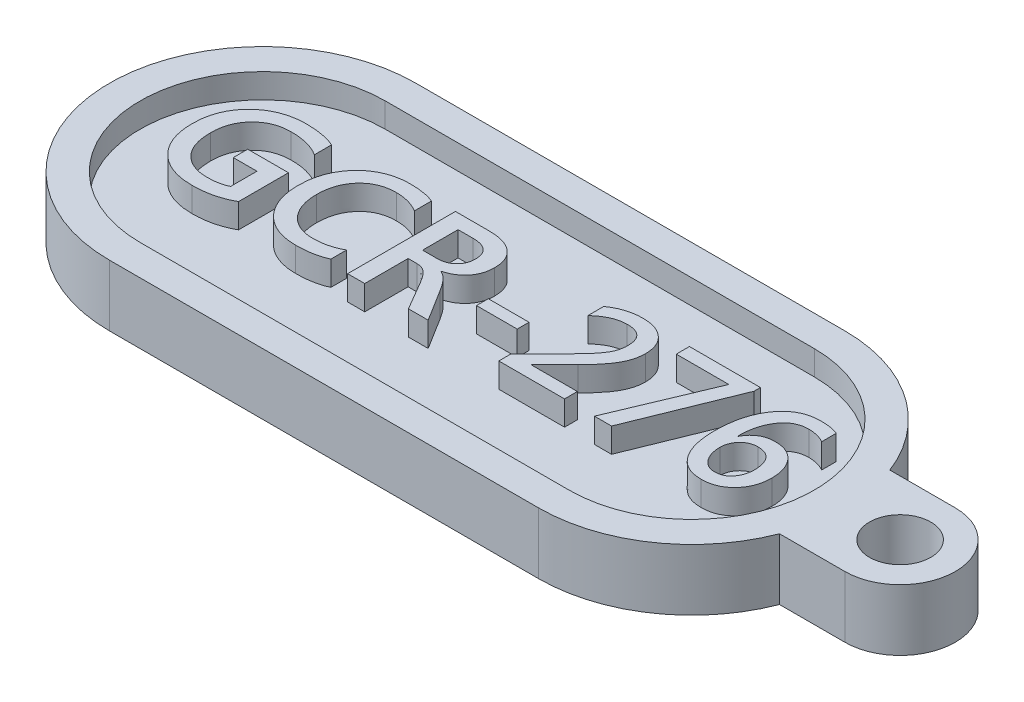
from build123d import *

# Parameters (mm, degrees)
EXTRUDE_1_DEPTH     = 5
CUT_EXTRUDE_1_DEPTH = 2
SKETCH_3_W          = 3.324021386
SKETCH_3_H          = 0.965038467
EXTRUDE_3_DEPTH     = 2
EXTRUDE_START       = -5
SKETCH_4_R          = 2.5
EXTRUDE_4_DEPTH     = 5


with BuildPart() as part:
    # 草圖1 → 填料-伸長1 (new body)
    with BuildSketch(Plane(origin=(0, 0, 0), x_dir=(1, 0, 0), z_dir=(0, 1, 0))):
        with BuildLine():
            Line((0, 12.5), (35, 12.5))
            ThreePointArc((35, 12.5), (47.5, 0), (35, -12.5))
            Line((35, -12.5), (0, -12.5))
            ThreePointArc((0, -12.5), (-12.5, 0), (0, 12.5))
        make_face()
    extrude(amount=EXTRUDE_1_DEPTH)

    # 草圖2 → 除料-伸長1 (cut)
    with BuildSketch(Plane(origin=(0, 5, 0), x_dir=(1, 0, 0), z_dir=(0, 1, 0))):
        with BuildLine():
            Line((0, -10), (35, -10))
            ThreePointArc((35, -10), (45, 0), (35, 10))
            Line((35, 10), (0, 10))
            ThreePointArc((0, 10), (-10, 0), (0, -10))
        make_face()
    extrude(amount=-CUT_EXTRUDE_1_DEPTH, mode=Mode.SUBTRACT)

    # 草圖3 → 填料-伸長3 (add)
    # profile 1 of 7: a face of its own
    with BuildSketch(Plane(origin=(0, 3, 0), x_dir=(1, 0, 0), z_dir=(0, 1, 0))):
        with BuildLine():
            add(Edge.make_bspline(
                [(1.130659793, -3.097159366), (1.019253484, -3.157505942), (0.795861792, -3.278512768), (0.444456536, -3.429566541), (0.081917786, -3.559128311), (-0.293630756, -3.66515192), (-0.68218148, -3.746765958), (-1.083381224, -3.805024328), (-1.496836615, -3.84126153), (-1.776667152, -3.845563125), (-1.918593697, -3.84774484)],
                knots=[0, 0, 0, 0, 0.957138089, 1.91925125, 2.887114869, 3.865167626, 4.865969151, 5.885472766, 6.927538269, 8, 8, 8, 8], degree=3))
            add(Edge.make_bspline(
                [(-1.918593697, -3.84774484), (-2.079584662, -3.844320978), (-2.394180526, -3.837630336), (-2.853703725, -3.782048463), (-3.287879366, -3.687371257), (-3.698830364, -3.560254118), (-4.082951545, -3.390308969), (-4.444514056, -3.1873112), (-4.780641428, -2.945157695), (-5.088711414, -2.666239458), (-5.366829262, -2.357742677), (-5.607791666, -2.019292881), (-5.813593187, -1.656550674), (-5.978864681, -1.266331283), (-6.110827777, -0.852722478), (-6.201556244, -0.412456478), (-6.258054494, 0.052815525), (-6.264613091, 0.371896915), (-6.267968454, 0.535138198)],
                knots=[0, 0, 0, 0, 1.107989924, 2.165146631, 3.180093165, 4.163722251, 5.120842657, 6.065943663, 7.013379634, 7.966073561, 8.921625378, 9.866820206, 10.820506458, 11.786679049, 12.778798332, 13.80421889, 14.876643591, 16, 16, 16, 16], degree=3))
            add(Edge.make_bspline(
                [(-6.267968454, 0.535138198), (-6.264350434, 0.70063782), (-6.257246718, 1.025584154), (-6.194255024, 1.5009336), (-6.089629116, 1.953398039), (-5.946663418, 2.383724926), (-5.758839432, 2.790647357), (-5.52997145, 3.173986767), (-5.260242121, 3.534747482), (-4.951083829, 3.868537839), (-4.608730533, 4.169556821), (-4.242549929, 4.437495759), (-3.849472947, 4.660369843), (-3.433922234, 4.844531928), (-2.993094901, 4.984710187), (-2.530074341, 5.08695358), (-2.042545642, 5.148294788), (-1.70990325, 5.155565905), (-1.539950131, 5.159280852)],
                knots=[0, 0, 0, 0, 1.069823103, 2.100518975, 3.093908996, 4.069174194, 5.027374187, 5.98610484, 6.951045497, 7.934917876, 8.922501358, 9.894793384, 10.863659021, 11.838643361, 12.828805145, 13.849577504, 14.901309579, 16, 16, 16, 16], degree=3))
            add(Edge.make_bspline(
                [(-1.539950131, 5.159280852), (-1.422632813, 5.15819235), (-1.191697059, 5.156049665), (-0.852425097, 5.133297086), (-0.52522666, 5.098864547), (-0.211614919, 5.048523283), (0.090114212, 4.98537216), (0.37787268, 4.906059527), (0.654050258, 4.815519234), (0.829567858, 4.740566425), (0.9162068, 4.703568243)],
                knots=[0, 0, 0, 0, 1.118819135, 2.202363179, 3.241788239, 4.255886137, 5.230622063, 6.180412027, 7.101815561, 8, 8, 8, 8], degree=3))
            Line((0.9162068, 4.703568243), (0.9162068, 3.309623791))
            add(Edge.make_bspline(
                [(0.9162068, 3.309623791), (0.826640041, 3.363786544), (0.646589506, 3.472666588), (0.358227687, 3.606526606), (0.058093278, 3.723314059), (-0.256570087, 3.816298628), (-0.584346031, 3.890960517), (-0.926625957, 3.941410997), (-1.28294617, 3.974823259), (-1.525350605, 3.978113211), (-1.648852042, 3.979789393)],
                knots=[0, 0, 0, 0, 0.934304809, 1.878175359, 2.835136939, 3.808892105, 4.806079926, 5.83539023, 6.897163674, 8, 8, 8, 8], degree=3))
            add(Edge.make_bspline(
                [(-1.648852042, 3.979789393), (-1.764599743, 3.976910385), (-1.991353841, 3.9712703), (-2.323396391, 3.926482229), (-2.63940132, 3.855019237), (-2.939716043, 3.754555545), (-3.223350867, 3.622808161), (-3.489971833, 3.46109732), (-3.741932302, 3.271994998), (-3.975181888, 3.055413509), (-4.185130734, 2.814300158), (-4.371675313, 2.55592628), (-4.52577667, 2.276704341), (-4.65398828, 1.980728668), (-4.752991476, 1.665652536), (-4.822093435, 1.332229763), (-4.867665069, 0.981497864), (-4.871876478, 0.741361603), (-4.874024002, 0.618908898)],
                knots=[0, 0, 0, 0, 1.06102007, 2.078578193, 3.066161544, 4.028066276, 4.976573964, 5.92769069, 6.882220097, 7.860559593, 8.840398954, 9.80952819, 10.776937682, 11.758648651, 12.762781852, 13.799272853, 14.877783005, 16, 16, 16, 16], degree=3))
            add(Edge.make_bspline(
                [(-4.874024002, 0.618908898), (-4.871501571, 0.493141622), (-4.866590014, 0.248253546), (-4.826995708, -0.108503178), (-4.765106664, -0.444790604), (-4.67339191, -0.758807801), (-4.561123035, -1.053469369), (-4.416352305, -1.323676051), (-4.250961405, -1.575828437), (-4.057792476, -1.803420011), (-3.842415432, -2.006404107), (-3.609199728, -2.185380669), (-3.35611372, -2.33556974), (-3.084306998, -2.455517568), (-2.795721485, -2.552284267), (-2.48861555, -2.620192249), (-2.163191543, -2.660980521), (-1.94049519, -2.665790203), (-1.826445926, -2.66825338)],
                knots=[0, 0, 0, 0, 1.188621482, 2.314427373, 3.389202348, 4.416793506, 5.40307169, 6.364246269, 7.308688229, 8.248974615, 9.178888234, 10.101761511, 11.022578782, 11.953690551, 12.905306186, 13.895392135, 14.922169253, 16, 16, 16, 16], degree=3))
            add(Edge.make_bspline(
                [(-1.826445926, -2.66825338), (-1.750467102, -2.667337474), (-1.601705329, -2.665544187), (-1.383078767, -2.650039696), (-1.173874167, -2.625369235), (-0.973620329, -2.590110998), (-0.782226505, -2.545002542), (-0.599746813, -2.489858403), (-0.426314706, -2.425256032), (-0.317090205, -2.372541715), (-0.263284659, -2.346573891)],
                knots=[0, 0, 0, 0, 1.132210773, 2.216797709, 3.264643496, 4.270390876, 5.245467881, 6.193346498, 7.110016752, 8, 8, 8, 8], degree=3))
            Line((-0.263284659, -2.346573891), (-0.263284659, -0.202043964))
            Line((-0.263284659, -0.202043964), (-2.193361593, -0.202043964))
            Line((-2.193361593, -0.202043964), (-2.193361593, 0.977447495))
            Line((-2.193361593, 0.977447495), (1.130659793, 0.977447495))
            Line((1.130659793, 0.977447495), (1.130659793, -3.097159366))
        make_face()
    # profile 2 of 7: a face of its own
    with BuildSketch(Plane(origin=(0, 3, 0), x_dir=(1, 0, 0), z_dir=(0, 1, 0))):
        with BuildLine():
            add(Edge.make_bspline(
                [(8.958194026, -3.392032231), (8.876040138, -3.429002668), (8.709609567, -3.50389883), (8.44536449, -3.595418239), (8.166800697, -3.673943753), (7.871765321, -3.737175366), (7.562597209, -3.78756191), (7.237042439, -3.821902252), (6.896641322, -3.844531212), (6.664031799, -3.846660636), (6.545597858, -3.84774484)],
                knots=[0, 0, 0, 0, 0.873229781, 1.769023159, 2.708553228, 3.678358573, 4.693321154, 5.744689587, 6.851700922, 8, 8, 8, 8], degree=3))
            add(Edge.make_bspline(
                [(6.545597858, -3.84774484), (6.393529579, -3.844306335), (6.095609591, -3.837569892), (5.66061916, -3.781909608), (5.248769354, -3.687926988), (4.86046036, -3.556829521), (4.493770932, -3.391032965), (4.15132129, -3.184613153), (3.832500537, -2.941008354), (3.539097671, -2.662151994), (3.27502196, -2.353798892), (3.046234601, -2.017572535), (2.850890399, -1.659242838), (2.690423464, -1.27666281), (2.569554447, -0.868945639), (2.480092863, -0.43872407), (2.428343203, 0.0156153), (2.421087015, 0.32613982), (2.417377749, 0.484875778)],
                knots=[0, 0, 0, 0, 1.081812089, 2.119399567, 3.114266169, 4.083181305, 5.031045332, 5.972246394, 6.922066112, 7.880624707, 8.847451274, 9.80531765, 10.769166742, 11.747078106, 12.751589147, 13.790507572, 14.870537192, 16, 16, 16, 16], degree=3))
            add(Edge.make_bspline(
                [(2.417377749, 0.484875778), (2.421195072, 0.650925585), (2.428687246, 0.976827841), (2.488836707, 1.453872378), (2.584699532, 1.909238626), (2.723792998, 2.341054597), (2.89663534, 2.753152571), (3.11576431, 3.139155287), (3.368727873, 3.505635995), (3.662272421, 3.84327499), (3.98283169, 4.15300276), (4.33159037, 4.422948632), (4.704139568, 4.649794507), (5.097955993, 4.837273464), (5.514612968, 4.981294021), (5.95278147, 5.085345047), (6.414174943, 5.14869969), (6.729689772, 5.155705159), (6.890733143, 5.159280852)],
                knots=[0, 0, 0, 0, 1.098062339, 2.155142483, 3.175320911, 4.1718764, 5.151715059, 6.125889682, 7.102505752, 8.09261102, 9.080232189, 10.046727831, 11.003409711, 11.960170045, 12.926354998, 13.913768876, 14.9351572, 16, 16, 16, 16], degree=3))
            add(Edge.make_bspline(
                [(6.890733143, 5.159280852), (6.992404083, 5.158543053), (7.190866448, 5.157102863), (7.481989035, 5.13923833), (7.760519011, 5.113515882), (8.025963648, 5.074669037), (8.278505234, 5.027004348), (8.516906832, 4.965626626), (8.743820231, 4.897141182), (8.887644368, 4.839211048), (8.958194026, 4.810794739)],
                knots=[0, 0, 0, 0, 1.156157513, 2.256827338, 3.316087736, 4.33651165, 5.306901744, 6.237369836, 7.135381876, 8, 8, 8, 8], degree=3))
            Line((8.958194026, 4.810794739), (8.958194026, 3.416850287))
            add(Edge.make_bspline(
                [(8.958194026, 3.416850287), (8.881798413, 3.462213922), (8.729761728, 3.552493148), (8.490275122, 3.66546423), (8.246078747, 3.763376312), (7.99494142, 3.841885643), (7.738242534, 3.90472569), (7.474870841, 3.947126293), (7.205779385, 3.975607925), (7.024282597, 3.978386225), (6.932618493, 3.979789393)],
                knots=[0, 0, 0, 0, 1.000698145, 1.991512659, 2.980166353, 3.963397223, 4.954011858, 5.955501226, 6.967435452, 8, 8, 8, 8], degree=3))
            add(Edge.make_bspline(
                [(6.932618493, 3.979789393), (6.817443416, 3.976861067), (6.592383369, 3.971138918), (6.263836912, 3.927414081), (5.953268445, 3.852719056), (5.658212306, 3.752014897), (5.382984758, 3.616052101), (5.123742712, 3.454524694), (4.882937392, 3.261876089), (4.661426884, 3.040979561), (4.460782573, 2.797917505), (4.287471268, 2.533835389), (4.13855442, 2.253507923), (4.020391082, 1.952803083), (3.925860674, 1.635122824), (3.859689006, 1.298561946), (3.818615738, 0.944402561), (3.813786002, 0.702235853), (3.811322202, 0.578698962)],
                knots=[0, 0, 0, 0, 1.063652607, 2.078450591, 3.054364451, 4.010361573, 4.95163226, 5.883370162, 6.826744596, 7.793357237, 8.768234429, 9.732531893, 10.706275672, 11.694827412, 12.711668615, 13.763788352, 14.859237769, 16, 16, 16, 16], degree=3))
            add(Edge.make_bspline(
                [(3.811322202, 0.578698962), (3.813126277, 0.460732417), (3.816659189, 0.229719036), (3.857472231, -0.10782051), (3.917063397, -0.429166653), (4.00793224, -0.732315009), (4.11833554, -1.019542288), (4.257961504, -1.288220733), (4.420078369, -1.540466865), (4.608144392, -1.773043699), (4.815543641, -1.98356534), (5.043308316, -2.166250283), (5.285953266, -2.323558097), (5.548474091, -2.448715225), (5.826328027, -2.549697833), (6.122733175, -2.615396838), (6.434653816, -2.662260091), (6.648727034, -2.666223381), (6.758375437, -2.66825338)],
                knots=[0, 0, 0, 0, 1.14570342, 2.243626122, 3.299431414, 4.317736089, 5.314423708, 6.285290861, 7.254700848, 8.223442235, 9.18663467, 10.120627236, 11.055470792, 11.989936226, 12.940896808, 13.921603267, 14.935444215, 16, 16, 16, 16], degree=3))
            add(Edge.make_bspline(
                [(6.758375437, -2.66825338), (6.861201738, -2.666868022), (7.063865509, -2.664137575), (7.36309075, -2.635786782), (7.653236035, -2.593492502), (7.933427124, -2.530772224), (8.204723294, -2.452436588), (8.46575248, -2.354566187), (8.718803293, -2.24183406), (8.878469421, -2.150779635), (8.958194026, -2.105314274)],
                knots=[0, 0, 0, 0, 1.073382705, 2.115565596, 3.135735895, 4.133203503, 5.111254161, 6.081800706, 7.04220336, 8, 8, 8, 8], degree=3))
            Line((8.958194026, -2.105314274), (8.958194026, -3.392032231))
        make_face()
    # profile 3 of 7: a face of its own
    with BuildSketch(Plane(origin=(0, 3, 0), x_dir=(1, 0, 0), z_dir=(0, 1, 0))):
        with BuildLine():
            Line((17.241440868, -3.740518344), (15.633043423, -3.740518344))
            Line((15.633043423, -3.740518344), (14.260879352, -1.393263322))
            add(Edge.make_bspline(
                [(14.260879352, -1.393263322), (14.228244511, -1.33778643), (14.16505205, -1.230363774), (14.068452371, -1.077933767), (13.97237545, -0.940651318), (13.880538643, -0.815900753), (13.790215528, -0.704921316), (13.701327402, -0.608136601), (13.616646079, -0.523078706), (13.504828759, -0.432338562), (13.362378576, -0.33875511), (13.177469773, -0.25814653), (12.979959798, -0.210141185), (12.843741799, -0.204765288), (12.77478713, -0.202043964)],
                knots=[0, 0, 0, 0, 1.154342948, 2.235211453, 3.235478647, 4.158981251, 5.013123199, 5.800080655, 6.515450744, 7.163104964, 8.379980877, 9.559726322, 10.764713421, 12, 12, 12, 12], degree=3))
            Line((12.77478713, -0.202043964), (12.067762419, -0.202043964))
            Line((12.067762419, -0.202043964), (12.067762419, -3.740518344))
            Line((12.067762419, -3.740518344), (10.673817967, -3.740518344))
            Line((10.673817967, -3.740518344), (10.673817967, 5.052054356))
            Line((10.673817967, 5.052054356), (13.43154942, 5.052054356))
            add(Edge.make_bspline(
                [(13.43154942, 5.052054356), (13.540513575, 5.05008016), (13.752684245, 5.046236083), (14.061793205, 5.017728289), (14.35213217, 4.970011017), (14.622767347, 4.901251355), (14.874777199, 4.813942553), (15.108328133, 4.70734968), (15.322096258, 4.579364952), (15.516136113, 4.432999166), (15.688924087, 4.26900643), (15.83940039, 4.087826917), (15.968228648, 3.891303153), (16.06981247, 3.676332951), (16.150711317, 3.446731998), (16.209781055, 3.201015919), (16.242735804, 2.938024131), (16.247267686, 2.757385791), (16.249595777, 2.664589399)],
                knots=[0, 0, 0, 0, 1.246590689, 2.427311831, 3.548161916, 4.609745165, 5.618131739, 6.595930334, 7.541634735, 8.46304448, 9.37149059, 10.260791202, 11.152269932, 12.052521811, 12.974064481, 13.933399661, 14.938359062, 16, 16, 16, 16], degree=3))
            add(Edge.make_bspline(
                [(16.249595777, 2.664589399), (16.247848518, 2.591376607), (16.24439833, 2.446808528), (16.221253413, 2.234265404), (16.180205954, 2.03000685), (16.12559572, 1.833446322), (16.053330899, 1.644891683), (15.963414245, 1.465056988), (15.860174939, 1.292387533), (15.74065656, 1.129215641), (15.605984937, 0.976858832), (15.459249385, 0.834362813), (15.298852795, 0.705165341), (15.12686361, 0.586661621), (14.941205034, 0.481448175), (14.742025803, 0.390220696), (14.532598307, 0.306129762), (14.385839976, 0.263591967), (14.311141773, 0.241940747)],
                knots=[0, 0, 0, 0, 1.046481847, 2.066413079, 3.051124139, 4.02152713, 4.979206117, 5.932383219, 6.892056265, 7.851629706, 8.818842683, 9.795496585, 10.771661027, 11.759183014, 12.778020318, 13.817261469, 14.889012671, 16, 16, 16, 16], degree=3))
            Line((14.311141773, 0.241940747), (14.311141773, 0.220160365))
            add(Edge.make_bspline(
                [(14.311141773, 0.220160365), (14.361556335, 0.19981622), (14.468121973, 0.156813033), (14.621976742, 0.058109627), (14.779943937, -0.069103321), (14.942221953, -0.226293196), (15.109624844, -0.412654272), (15.279939808, -0.630236295), (15.45611305, -0.876724794), (15.570167134, -1.054299984), (15.629692595, -1.146977463)],
                knots=[0, 0, 0, 0, 0.674944805, 1.426689433, 2.261975859, 3.195382928, 4.233133748, 5.375432636, 6.630223696, 8, 8, 8, 8], degree=3))
            Line((15.629692595, -1.146977463), (17.241440868, -3.740518344))
        make_face()
        with BuildLine():
            Line((12.067762419, 3.872562896), (12.067762419, 0.977447495))
            Line((12.067762419, 0.977447495), (13.243903051, 0.977447495))
            add(Edge.make_bspline(
                [(13.243903051, 0.977447495), (13.303725851, 0.978637652), (13.420374371, 0.98095834), (13.590697269, 1.001865658), (13.752175308, 1.034082279), (13.903535912, 1.084084484), (14.046704595, 1.143587135), (14.180708551, 1.218025314), (14.304056048, 1.307234043), (14.418864804, 1.407464354), (14.519760748, 1.520212221), (14.611303785, 1.638397774), (14.687106247, 1.765753564), (14.749664366, 1.899704263), (14.79597019, 2.042381531), (14.831883121, 2.191178414), (14.851826415, 2.347953048), (14.854361692, 2.454551759), (14.855651324, 2.508775896)],
                knots=[0, 0, 0, 0, 1.148173078, 2.238823515, 3.290343563, 4.30428618, 5.294127576, 6.263782772, 7.239820457, 8.212258366, 9.183868215, 10.140390316, 11.078278464, 12.023433147, 12.972896838, 13.953459634, 14.958975359, 16, 16, 16, 16], degree=3))
            add(Edge.make_bspline(
                [(14.855651324, 2.508775896), (14.854350069, 2.564123082), (14.851831947, 2.671228126), (14.832880981, 2.82645556), (14.803719212, 2.970986651), (14.760085536, 3.105000873), (14.701990759, 3.227007203), (14.636305651, 3.341869401), (14.55156558, 3.441313726), (14.460846109, 3.535718275), (14.352212966, 3.614036054), (14.233926967, 3.684840915), (14.102194576, 3.743431997), (13.95877962, 3.789826053), (13.803068411, 3.827051794), (13.634941069, 3.852692936), (13.454265635, 3.870470766), (13.329954455, 3.871849874), (13.265683433, 3.872562896)],
                knots=[0, 0, 0, 0, 1.107036465, 2.142280367, 3.12398577, 4.053233307, 4.952995046, 5.824852566, 6.690386988, 7.559447903, 8.437654071, 9.359347722, 10.314563554, 11.314475318, 12.371379263, 13.513931553, 14.714659784, 16, 16, 16, 16], degree=3))
            Line((13.265683433, 3.872562896), (12.067762419, 3.872562896))
        make_face(mode=Mode.SUBTRACT)
    # profile 4 of 7: a face of its own
    with BuildSketch(Plane(origin=(0, 3, 0), x_dir=(1, 0, 0), z_dir=(0, 1, 0))):
        with Locations((19.841683404, -0.255657213)):
            Rectangle(SKETCH_3_W, SKETCH_3_H)
    # profile 5 of 7: a face of its own
    with BuildSketch(Plane(origin=(0, 3, 0), x_dir=(1, 0, 0), z_dir=(0, 1, 0))):
        with BuildLine():
            Line((28.366189863, -3.740518344), (23.004865046, -3.740518344))
            Line((23.004865046, -3.740518344), (23.004865046, -2.73526994))
            Line((23.004865046, -2.73526994), (25.534740194, -0.197017722))
            add(Edge.make_bspline(
                [(25.534740194, -0.197017722), (25.603126812, -0.128014251), (25.736583346, 0.006646074), (25.92704134, 0.207194568), (26.104140082, 0.400996446), (26.267502457, 0.587358626), (26.416876739, 0.766521568), (26.55194763, 0.938712699), (26.673615968, 1.103235834), (26.782870644, 1.262208229), (26.878088892, 1.419616475), (26.96027856, 1.579173625), (27.031196861, 1.741711056), (27.088399129, 1.908098998), (27.131830048, 2.078555597), (27.163816215, 2.252013594), (27.182458765, 2.429066931), (27.18527856, 2.547826597), (27.186698403, 2.607625322)],
                knots=[0, 0, 0, 0, 1.392997405, 2.718435426, 3.965450539, 5.157194893, 6.271696389, 7.309755733, 8.294753645, 9.205397777, 10.074719714, 10.930698409, 11.777147309, 12.615374368, 13.450535761, 14.297136164, 15.142561707, 16, 16, 16, 16], degree=3))
            add(Edge.make_bspline(
                [(27.186698403, 2.607625322), (27.185162664, 2.667409576), (27.182185502, 2.783306439), (27.166386602, 2.951635903), (27.135857227, 3.107931678), (27.094485932, 3.253688754), (27.039077761, 3.386986361), (26.973346858, 3.510133296), (26.894752788, 3.620195662), (26.804319755, 3.719330443), (26.701659613, 3.807093377), (26.585567968, 3.881802063), (26.458813873, 3.946178639), (26.320033049, 3.998226082), (26.168976934, 4.038114711), (26.005735794, 4.065536439), (25.831210729, 4.085332129), (25.710719195, 4.086443536), (25.648668346, 4.087015889)],
                knots=[0, 0, 0, 0, 1.172302079, 2.272607347, 3.309709031, 4.290252302, 5.237720018, 6.134223326, 7.021317794, 7.881520182, 8.75910494, 9.661007113, 10.581523441, 11.541309508, 12.561103097, 13.639288866, 14.78427865, 16, 16, 16, 16], degree=3))
            add(Edge.make_bspline(
                [(25.648668346, 4.087015889), (25.552973719, 4.084242268), (25.36099557, 4.078677957), (25.075774993, 4.029395553), (24.7931602, 3.952259863), (24.514349041, 3.841592809), (24.236710392, 3.702482067), (23.963727858, 3.529717515), (23.692051346, 3.328722151), (23.521299988, 3.174319325), (23.433771031, 3.095170798)],
                knots=[0, 0, 0, 0, 0.92311185, 1.851904442, 2.785705468, 3.746745128, 4.742434459, 5.779007421, 6.86149564, 8, 8, 8, 8], degree=3))
            Line((23.433771031, 3.095170798), (23.433771031, 4.381888754))
            add(Edge.make_bspline(
                [(23.433771031, 4.381888754), (23.522633555, 4.444411576), (23.699083583, 4.56856013), (23.980779409, 4.724612656), (24.269883301, 4.860932385), (24.570516407, 4.968583034), (24.879885872, 5.05543686), (25.199549328, 5.114573399), (25.5287601, 5.153252047), (25.751873793, 5.157254911), (25.864796753, 5.159280852)],
                knots=[0, 0, 0, 0, 1.003583112, 1.9927666, 2.971919861, 3.954902358, 4.940469962, 5.938649198, 6.956703062, 8, 8, 8, 8], degree=3))
            add(Edge.make_bspline(
                [(25.864796753, 5.159280852), (25.961496723, 5.157438452), (26.150916414, 5.153829487), (26.42710527, 5.123091911), (26.688758145, 5.073948983), (26.933852071, 5.000825713), (27.165830884, 4.910901142), (27.381476468, 4.798189686), (27.583434276, 4.66700499), (27.766795125, 4.514248584), (27.933339611, 4.345451869), (28.078163649, 4.159848052), (28.201738033, 3.959682178), (28.300074471, 3.74289014), (28.379564666, 3.513215648), (28.434844672, 3.267713081), (28.466096012, 3.007747124), (28.47094089, 2.82942203), (28.473416359, 2.738307615)],
                knots=[0, 0, 0, 0, 1.153407188, 2.259339208, 3.311284359, 4.325409769, 5.306604542, 6.275161714, 7.223218613, 8.174454568, 9.116804544, 10.047158633, 10.97736955, 11.916486756, 12.881553951, 13.872406806, 14.912915701, 16, 16, 16, 16], degree=3))
            add(Edge.make_bspline(
                [(28.473416359, 2.738307615), (28.472061238, 2.670694285), (28.469345092, 2.535173034), (28.449357038, 2.332308683), (28.412493312, 2.130247692), (28.367189678, 1.927571082), (28.303714274, 1.726091788), (28.228925859, 1.524161314), (28.137033792, 1.323882168), (28.035222081, 1.119979804), (27.911679492, 0.914625722), (27.772768489, 0.699113223), (27.611703909, 0.47492761), (27.428479351, 0.243164581), (27.226893596, 0.000684622), (27.004074623, -0.249777753), (26.760691691, -0.509750236), (26.589514951, -0.683814034), (26.501454075, -0.77336014)],
                knots=[0, 0, 0, 0, 0.784436379, 1.572290565, 2.361635388, 3.166360898, 3.980010205, 4.81041122, 5.663038003, 6.535258449, 7.453141242, 8.441606403, 9.509667226, 10.654195165, 11.86873382, 13.167672897, 14.542925831, 16, 16, 16, 16], degree=3))
            Line((26.501454075, -0.77336014), (24.613262491, -2.66825338))
            Line((24.613262491, -2.66825338), (24.613262491, -2.69338459))
            Line((24.613262491, -2.69338459), (28.366189863, -2.69338459))
            Line((28.366189863, -2.69338459), (28.366189863, -3.740518344))
        make_face()
    # profile 6 of 7: a face of its own
    with BuildSketch(Plane(origin=(0, 3, 0), x_dir=(1, 0, 0), z_dir=(0, 1, 0))):
        Polygon((35.550365117, 4.5310006), (32.199537107, -3.740518344), (30.805592654, -3.740518344), (34.049194169, 3.979789393), (29.760134315, 3.979789393), (29.760134315, 5.052054356), (35.550365117, 5.052054356), align=None)
    # profile 7 of 7: a face of its own
    with BuildSketch(Plane(origin=(0, 3, 0), x_dir=(1, 0, 0), z_dir=(0, 1, 0))):
        with BuildLine():
            add(Edge.make_bspline(
                [(41.876728401, 3.725126464), (41.76641706, 3.781486661), (41.547234849, 3.89347109), (41.194479624, 4.002543143), (40.831549817, 4.075978202), (40.584241626, 4.083311763), (40.459328153, 4.087015889)],
                knots=[0, 0, 0, 0, 1.003933492, 1.994757388, 2.987167308, 4, 4, 4, 4], degree=3))
            add(Edge.make_bspline(
                [(40.459328153, 4.087015889), (40.368689923, 4.084074556), (40.191355396, 4.07831981), (39.932023698, 4.034419176), (39.687973476, 3.958387654), (39.458270982, 3.853754778), (39.242663819, 3.72047174), (39.044761278, 3.554245869), (38.86078803, 3.35946138), (38.69282218, 3.13724433), (38.543199502, 2.891338967), (38.412290385, 2.627238246), (38.301047647, 2.346692599), (38.213309129, 2.047966705), (38.141969068, 1.733116999), (38.095445885, 1.40018534), (38.063253418, 1.050685588), (38.061191187, 0.811660424), (38.060135297, 0.689276286)],
                knots=[0, 0, 0, 0, 0.933904692, 1.827193088, 2.701077178, 3.561397044, 4.422294371, 5.305193062, 6.217218874, 7.178482756, 8.170598597, 9.179667553, 10.21326055, 11.27676033, 12.385557583, 13.537398538, 14.739114524, 16, 16, 16, 16], degree=3))
            Line((38.060135297, 0.689276286), (38.088617335, 0.689276286))
            add(Edge.make_bspline(
                [(38.088617335, 0.689276286), (38.140602592, 0.78004463), (38.241665251, 0.956504085), (38.426492146, 1.1921242), (38.63341847, 1.392191091), (38.864051567, 1.554156348), (39.115074743, 1.682527656), (39.389608056, 1.770137976), (39.68532425, 1.825196856), (39.88999264, 1.831842237), (39.995238473, 1.835259466)],
                knots=[0, 0, 0, 0, 1.066700291, 2.073733464, 3.045468928, 3.994513252, 4.940418813, 5.912154277, 6.92637518, 8, 8, 8, 8], degree=3))
            add(Edge.make_bspline(
                [(39.995238473, 1.835259466), (40.085269737, 1.833100651), (40.261579298, 1.828873013), (40.518695333, 1.793063882), (40.761860135, 1.734511066), (40.990848123, 1.652554629), (41.205383307, 1.545919222), (41.405877071, 1.416579941), (41.591398492, 1.262437215), (41.761302558, 1.086550833), (41.915686013, 0.893125239), (42.047907718, 0.682258515), (42.161115216, 0.458066036), (42.253310336, 0.218906361), (42.324944332, -0.03469137), (42.377185334, -0.302452097), (42.407244729, -0.584461759), (42.410963182, -0.777198029), (42.412860883, -0.875560395)],
                knots=[0, 0, 0, 0, 1.05579154, 2.067572248, 3.038458292, 3.985532859, 4.914325196, 5.842932662, 6.778241305, 7.737295512, 8.707274838, 9.676058653, 10.651729643, 11.649391143, 12.678000959, 13.739307078, 14.846262283, 16, 16, 16, 16], degree=3))
            add(Edge.make_bspline(
                [(42.412860883, -0.875560395), (42.410816134, -0.980105969), (42.406800764, -1.185407014), (42.369032949, -1.486549449), (42.307320749, -1.773618337), (42.221360259, -2.047492685), (42.111297558, -2.307918174), (41.973510881, -2.55371774), (41.814899478, -2.787874105), (41.630668918, -3.004038126), (41.428953863, -3.201857922), (41.210667742, -3.37507939), (40.978195622, -3.521894074), (40.732067348, -3.641452877), (40.472006045, -3.734512912), (40.197633774, -3.798613886), (39.909962631, -3.84056455), (39.713361404, -3.845322102), (39.61324408, -3.84774484)],
                knots=[0, 0, 0, 0, 1.096860401, 2.153956187, 3.179460175, 4.174959479, 5.162419532, 6.141072475, 7.127923462, 8.126093864, 9.116749702, 10.088921661, 11.045130174, 11.996728517, 12.9552338, 13.937618428, 14.949751606, 16, 16, 16, 16], degree=3))
            add(Edge.make_bspline(
                [(39.61324408, -3.84774484), (39.500214985, -3.844771781), (39.279685951, -3.838971098), (38.959630935, -3.786676547), (38.658659201, -3.706707435), (38.380062565, -3.586606287), (38.119068679, -3.43830323), (37.88211724, -3.250403289), (37.662294673, -3.033778531), (37.466677387, -2.782059169), (37.293389129, -2.502312014), (37.142009514, -2.196378824), (37.01294838, -1.866388798), (36.910029597, -1.509934406), (36.827457344, -1.130011749), (36.772477112, -0.724374787), (36.735943418, -0.294862298), (36.731921659, 4.1854e-05), (36.729856577, 0.151468391)],
                knots=[0, 0, 0, 0, 0.974210229, 1.900764063, 2.790070519, 3.653429405, 4.510205702, 5.371627416, 6.253808617, 7.166358313, 8.114020019, 9.087718048, 10.106562953, 11.165903003, 12.284529251, 13.456903643, 14.694178186, 16, 16, 16, 16], degree=3))
            add(Edge.make_bspline(
                [(36.729856577, 0.151468391), (36.732623492, 0.331397106), (36.738046133, 0.684024129), (36.784223354, 1.199970561), (36.858111324, 1.691273088), (36.965994014, 2.155734402), (37.100934489, 2.596215383), (37.2689628, 3.009980981), (37.464930368, 3.400054728), (37.655876233, 3.702485698), (37.82151702, 3.92974969), (37.952018774, 4.088460977), (38.087779173, 4.236872542), (38.230958179, 4.372942999), (38.380132984, 4.498356212), (38.534020425, 4.614314609), (38.693809628, 4.718932403), (38.860476263, 4.811144105), (39.033074175, 4.892676933), (39.210653909, 4.966373202), (39.395980158, 5.023068447), (39.585439824, 5.074858455), (39.781480574, 5.112933264), (39.983512118, 5.139200114), (40.190945528, 5.156925804), (40.331400982, 5.158490375), (40.402364077, 5.159280852)],
                knots=[0, 0, 0, 0, 1.858078751, 3.641490884, 5.345682524, 6.985560481, 8.561888668, 10.098964768, 11.592577691, 13.06489883, 13.787119894, 14.496136704, 15.186031076, 15.863294791, 16.534637393, 17.19797789, 17.852329344, 18.505586671, 19.16351308, 19.823333171, 20.489176848, 21.163560515, 21.851353792, 22.549660798, 23.267237008, 24, 24, 24, 24], degree=3))
            add(Edge.make_bspline(
                [(40.402364077, 5.159280852), (40.478330538, 5.158791501), (40.62589394, 5.157840944), (40.841132009, 5.146079297), (41.043937723, 5.125658488), (41.234789717, 5.099746492), (41.413345066, 5.064723654), (41.579158899, 5.020586088), (41.733996843, 4.972079429), (41.830135597, 4.930025321), (41.876728401, 4.909644166)],
                knots=[0, 0, 0, 0, 1.210227092, 2.350843026, 3.432754361, 4.457041502, 5.418535653, 6.329286279, 7.190303245, 8, 8, 8, 8], degree=3))
            Line((41.876728401, 4.909644166), (41.876728401, 3.725126464))
        make_face()
        with BuildLine():
            add(Edge.make_bspline(
                [(38.123801029, -0.83199963), (38.125069351, -0.898504692), (38.127569322, -1.029591828), (38.147875694, -1.222318515), (38.181886795, -1.406850805), (38.225800892, -1.584121505), (38.287899148, -1.751846438), (38.358509503, -1.914025537), (38.447491085, -2.066163385), (38.544374029, -2.211777301), (38.654172333, -2.342951555), (38.772359893, -2.45838507), (38.898981855, -2.556949897), (39.034378914, -2.636695964), (39.177333827, -2.70073704), (39.329284769, -2.743142374), (39.488773265, -2.771336886), (39.598040876, -2.774085809), (39.653454016, -2.775479877)],
                knots=[0, 0, 0, 0, 1.156875721, 2.280300501, 3.366599911, 4.419985519, 5.452644387, 6.474689925, 7.493034063, 8.51438661, 9.514584662, 10.462794006, 11.383986154, 12.298802482, 13.190627173, 14.100839776, 15.036874421, 16, 16, 16, 16], degree=3))
            add(Edge.make_bspline(
                [(39.653454016, -2.775479877), (39.708259804, -2.773777785), (39.815592852, -2.770444366), (39.972587723, -2.747029553), (40.120679928, -2.706235353), (40.260908043, -2.651635266), (40.391426599, -2.577831758), (40.513735451, -2.48936766), (40.626605382, -2.384083106), (40.730435398, -2.265040012), (40.823028437, -2.133895587), (40.903659277, -1.99392903), (40.972884911, -1.847228573), (41.030192204, -1.692715904), (41.073567507, -1.52998294), (41.103106943, -1.360050521), (41.122179589, -1.183150555), (41.12480357, -1.062698632), (41.126142927, -1.001216445)],
                knots=[0, 0, 0, 0, 1.017989226, 1.99365598, 2.939924192, 3.866539785, 4.781467024, 5.7173282, 6.664335396, 7.642205805, 8.646785848, 9.641460883, 10.63921483, 11.6567282, 12.69854304, 13.762842006, 14.858089095, 16, 16, 16, 16], degree=3))
            add(Edge.make_bspline(
                [(41.126142927, -1.001216445), (41.124586986, -0.93250231), (41.121558989, -0.798778616), (41.105922637, -0.604287529), (41.074965083, -0.421910499), (41.03440603, -0.251741573), (40.979722368, -0.093898206), (40.915309868, 0.051994232), (40.83741095, 0.185457386), (40.748747609, 0.306794453), (40.648085752, 0.414303573), (40.536115613, 0.507758105), (40.413090693, 0.586384349), (40.280210943, 0.652302565), (40.136205707, 0.703008983), (39.980891988, 0.737214163), (39.814961754, 0.759886504), (39.700444847, 0.761941037), (39.641726118, 0.762994503)],
                knots=[0, 0, 0, 0, 1.256958577, 2.446150928, 3.564454453, 4.637095458, 5.641634732, 6.615431365, 7.549140329, 8.462288457, 9.358310836, 10.235804379, 11.122581324, 12.022437592, 12.943094915, 13.906931237, 14.926775615, 16, 16, 16, 16], degree=3))
            add(Edge.make_bspline(
                [(39.641726118, 0.762994503), (39.588589278, 0.761911708), (39.484634856, 0.759793378), (39.331927777, 0.737060362), (39.186502033, 0.700625985), (39.047660064, 0.64925237), (38.913948725, 0.586323715), (38.788636242, 0.504670548), (38.669182942, 0.410481026), (38.557021676, 0.303746462), (38.456661726, 0.18560833), (38.365696507, 0.061428095), (38.293001145, -0.072485197), (38.229936808, -0.210762844), (38.183470883, -0.357272669), (38.147753439, -0.508873351), (38.127525079, -0.668380939), (38.125060678, -0.776656115), (38.123801029, -0.83199963)],
                knots=[0, 0, 0, 0, 1.037421124, 2.029562012, 3.008658972, 3.961319774, 4.917784126, 5.88931378, 6.875920005, 7.886840501, 8.908129084, 9.901229374, 10.887835598, 11.879316359, 12.866103552, 13.885058291, 14.91897373, 16, 16, 16, 16], degree=3))
        make_face(mode=Mode.SUBTRACT)
    extrude(amount=EXTRUDE_3_DEPTH)

    # 草圖4 → 填料-伸長4 (add)
    with BuildSketch(Plane(origin=(0, 5, 0), x_dir=(1, 0, 0), z_dir=(0, 1, 0)).offset(EXTRUDE_START)):
        with BuildLine():
            Line((52, 4.5), (46.66190379, 4.5))
            ThreePointArc((46.66190379, 4.5), (47.5, 0), (46.66190379, -4.5))
            Line((46.66190379, -4.5), (52, -4.5))
            ThreePointArc((52, -4.5), (56.5, 0), (52, 4.5))
        make_face()
        with Locations(Location((52, 0, 0), (0, 0, 270))):
            Circle(SKETCH_4_R, mode=Mode.SUBTRACT)
    extrude(amount=EXTRUDE_4_DEPTH)


solid = part.part
